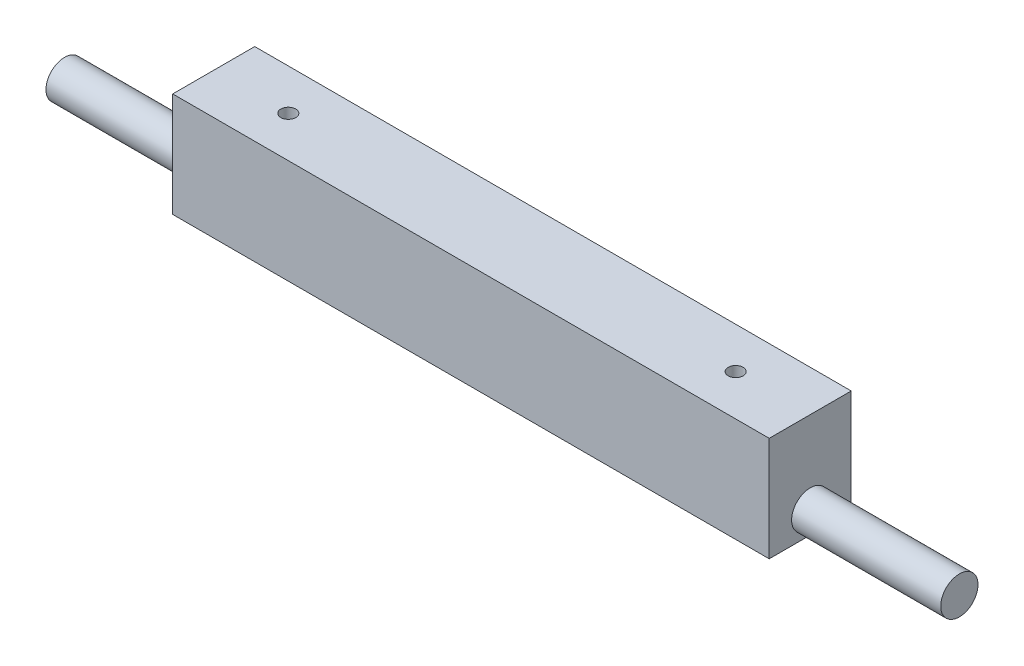
from build123d import *

# Parameters (mm, degrees)
SKETCH2_R           = 12.5
BOSS_EXTRUDE1_DEPTH = 300
SKETCH3_W           = 55
SKETCH3_H           = 70
BOSS_EXTRUDE2_DEPTH = 200
SKETCH4_R           = 5
CUT_EXTRUDE1_DEPTH  = 310.283446049


with BuildPart() as part:
    # Sketch2 → Boss-Extrude1 (new, symmetric)
    with BuildSketch(Plane(origin=(0, 0, 0), x_dir=(0, 0, -1), z_dir=(1, 0, 0))):
        Circle(SKETCH2_R)
    extrude(amount=BOSS_EXTRUDE1_DEPTH, both=True)

    # Sketch3 → Boss-Extrude2 (add, symmetric)
    with BuildSketch(Plane(origin=(0, 0, 0), x_dir=(0, 0, -1), z_dir=(1, 0, 0))):
        with Locations((0, 20)):
            Rectangle(SKETCH3_W, SKETCH3_H)
    extrude(amount=BOSS_EXTRUDE2_DEPTH, both=True)

    # Sketch4 → Cut-Extrude1 (cut, through all)
    with BuildSketch(Plane(origin=(0, 55, 0), x_dir=(1, 0, 0), z_dir=(0, 1, 0))):
        with Locations(Location((150, 0, 0), (0, 0, 270))):
            Circle(SKETCH4_R)
        with Locations(Location((-150, 0, 0), (0, 0, 90))):
            Circle(SKETCH4_R)
    extrude(amount=-CUT_EXTRUDE1_DEPTH, mode=Mode.SUBTRACT)


solid = part.part
